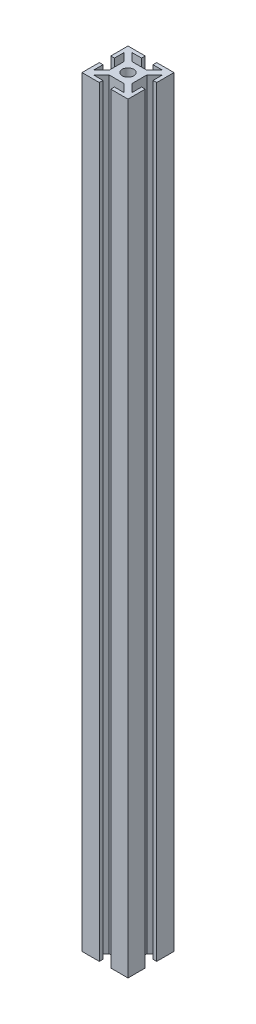
from build123d import *

# Parameters (mm, degrees)
SKETCH1_R               = 2.5
BOSS_EXTRUDE1_DEPTH     = 331
ENL_V_MAT_EXTRU_1_DEPTH = 331


with BuildPart() as part:
    # Sketch1 → Boss-Extrude1 (new body)
    with BuildSketch(Plane(origin=(0, 0, 0), x_dir=(1, 0, 0), z_dir=(0, 1, 0))):
        Polygon((2.5, -10), (10, -10), (10, -2.5), (5, -2.5), (5, 2.5), (10, 2.5), (10, 10), (2.5, 10), (2.5, 5), (-2.5, 5), (-2.5, 10), (-10, 10), (-10, 2.5), (-5, 2.5), (-5, -2.5), (-10, -2.5), (-10, -10), (-2.5, -10), (-2.5, -5), (2.5, -5), align=None)
        with Locations(Location((0, 0, 0), (0, 0, 270))):
            Circle(SKETCH1_R, mode=Mode.SUBTRACT)
    extrude(amount=BOSS_EXTRUDE1_DEPTH)

    # Esquisse1 → Enlèv. mat.-Extru.1 (cut)
    with BuildSketch(Plane(origin=(0, 331, 0), x_dir=(1, 0, 0), z_dir=(0, 1, 0))):
        Polygon((-6.585786438, 8.403805922), (-2.5, 8.403805922), (-2.5, 5), (-3.181980515, 5), align=None)
        Polygon((-5, 3.181980515), (-8.403805922, 6.585786438), (-8.403805922, 2.5), (-5, 2.5), align=None)
        Polygon((-3.181980515, -5), (-2.5, -5), (-2.5, -8.403805922), (-6.585786438, -8.403805922), align=None)
        Polygon((-8.403805922, -2.5), (-5, -2.5), (-5, -3.181980515), (-8.403805922, -6.585786438), align=None)
        Polygon((6.585786438, -8.403805922), (2.5, -8.403805922), (2.5, -5), (3.181980515, -5), align=None)
        Polygon((5, -2.5), (5, -3.181980515), (8.403805922, -6.585786438), (8.403805922, -2.5), align=None)
        Polygon((8.403805922, 2.5), (5, 2.5), (5, 3.181980515), (8.403805922, 6.585786438), align=None)
        Polygon((3.181980515, 5), (2.5, 5), (2.5, 8.403805922), (6.585786438, 8.403805922), align=None)
    extrude(amount=-ENL_V_MAT_EXTRU_1_DEPTH, mode=Mode.SUBTRACT)


solid = part.part
